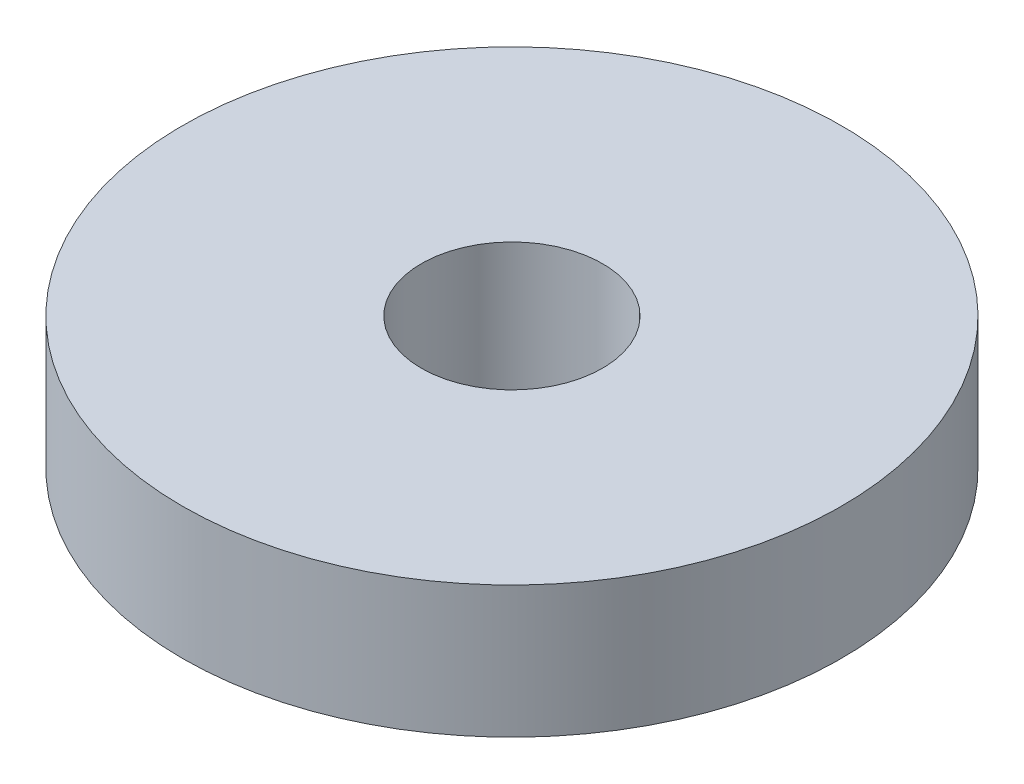
from build123d import *

# Parameters (mm, degrees)
SKETCH1_R           = 100
BOSS_EXTRUDE1_DEPTH = 40
SKETCH2_R           = 27.499999991
CUT_EXTRUDE1_DEPTH  = 147.969384567


with BuildPart() as part:
    # Sketch1 → Boss-Extrude1 (new body)
    with BuildSketch(Plane(origin=(0, 0, 0), x_dir=(1, 0, 0), z_dir=(0, 1, 0))):
        with Locations(Location((0, 0, 0), (0, 0, 270))):
            Circle(SKETCH1_R)
    extrude(amount=BOSS_EXTRUDE1_DEPTH)

    # Sketch2 → Cut-Extrude1 (cut, through all)
    with BuildSketch(Plane(origin=(0, 40, 0), x_dir=(1, 0, 0), z_dir=(0, 1, 0))):
        with Locations(Location((0, 0, 0), (0, 0, 270))):
            Circle(SKETCH2_R)
    extrude(amount=-CUT_EXTRUDE1_DEPTH, mode=Mode.SUBTRACT)


solid = part.part
